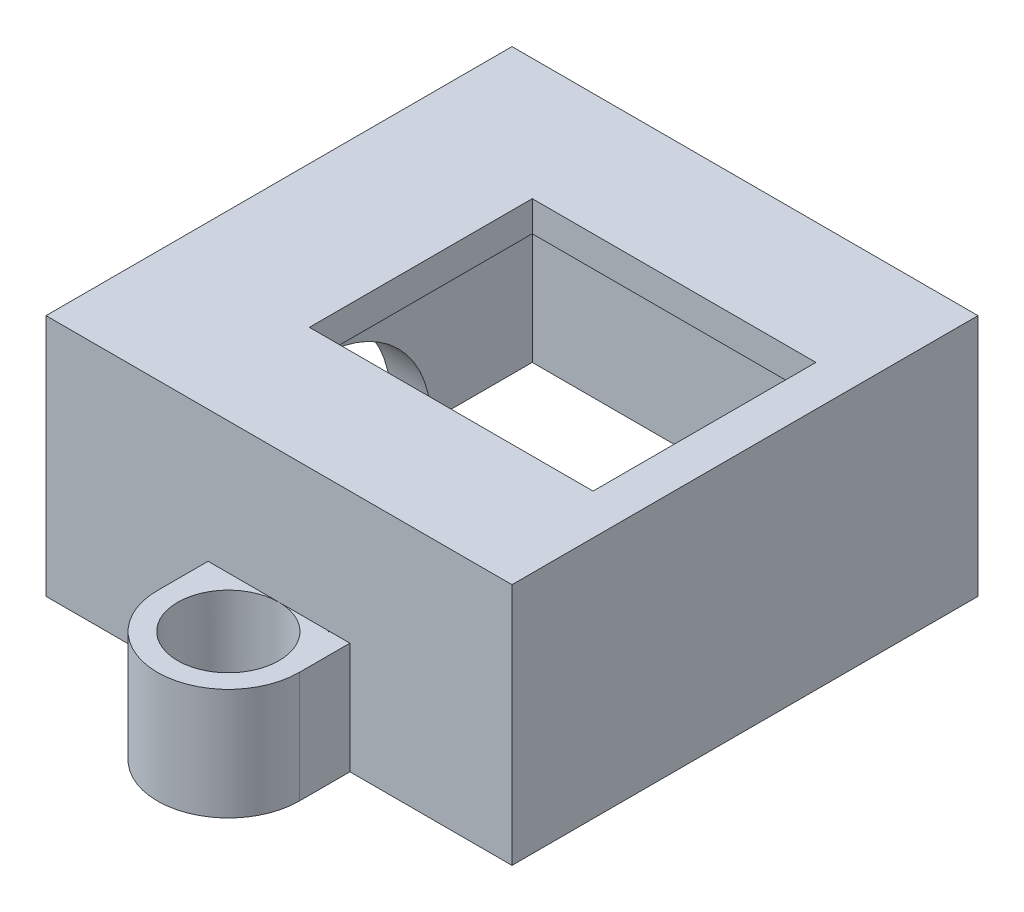
from build123d import *

# Parameters (mm, degrees)
ESBO_O1_W                = 46
ESBO_O1_H                = 46
ESBO_O1_W_2              = 38
ESBO_O1_H_2              = 42
RESSALTO_EXTRUS_O1_DEPTH = 10
ESBO_O2_W                = 46
ESBO_O2_H                = 46
ESBO_O2_W_2              = 28
ESBO_O2_H_2              = 22
RESSALTO_EXTRUS_O2_DEPTH = 3
ESBO_O1_4_W              = 38
ESBO_O1_4_H              = 42
ESBO_O1_4_R              = 5
RESSALTO_EXTRUS_O3_DEPTH = 11
ESBO_O3_R                = 11
CORTE_EXTRUS_O1_DEPTH    = 11


with BuildPart() as part:
    # Esboço1 → Ressalto-extrusão1 (new body)
    with BuildSketch(Plane(origin=(0, 0, 0), x_dir=(1, 0, 0), z_dir=(0, 1, 0))):
        Rectangle(ESBO_O1_W, ESBO_O1_H)
        Rectangle(ESBO_O1_W_2, ESBO_O1_H_2, mode=Mode.SUBTRACT)
    extrude(amount=RESSALTO_EXTRUS_O1_DEPTH)

    # Esboço2 → Ressalto-extrusão2 (add)
    with BuildSketch(Plane(origin=(0, 10, 0), x_dir=(1, 0, 0), z_dir=(0, 1, 0))):
        Rectangle(ESBO_O2_W, ESBO_O2_H)
        with Locations((5, 0)):
            Rectangle(ESBO_O2_W_2, ESBO_O2_H_2, mode=Mode.SUBTRACT)
    extrude(amount=RESSALTO_EXTRUS_O2_DEPTH)

    # Esboço1<4> → Ressalto-extrusão3 (add)
    with BuildSketch(Plane(origin=(0, 0, 0), x_dir=(1, 0, 0), z_dir=(0, 1, 0))):
        with BuildLine():
            Line((-7, -23), (-7, -28))
            ThreePointArc((-7, -28), (0, -35), (7, -28))
            Line((7, -28), (7, -23))
            Line((7, -23), (23, -23))
            Line((23, -23), (23, 23))
            Line((23, 23), (7, 23))
            Line((7, 23), (7, 28))
            ThreePointArc((7, 28), (0, 35), (-7, 28))
            Line((-7, 28), (-7, 23))
            Line((-7, 23), (-23, 23))
            Line((-23, 23), (-23, -23))
            Line((-23, -23), (-7, -23))
        make_face()
        Rectangle(ESBO_O1_4_W, ESBO_O1_4_H, mode=Mode.SUBTRACT)
        with BuildLine():
            Line((4.898979486, -23), (5, -23))
            Line((5, -23), (5, -23.101020514))
            ThreePointArc((5, -23.101020514), (4.949747468, -23.050252532), (4.898979486, -23))
        make_face(mode=Mode.SUBTRACT)
        with Locations((0, -28)):
            Circle(ESBO_O1_4_R, mode=Mode.SUBTRACT)
        with Locations((0, 28)):
            Circle(ESBO_O1_4_R, mode=Mode.SUBTRACT)
    extrude(amount=-RESSALTO_EXTRUS_O3_DEPTH)

    # Esboço3 → Corte-extrusão1 (cut)
    with BuildSketch(Plane.ZY.offset(23)):
        with Locations((0, -11)):
            Circle(ESBO_O3_R)
    extrude(amount=-CORTE_EXTRUS_O1_DEPTH, mode=Mode.SUBTRACT)


solid = part.part
